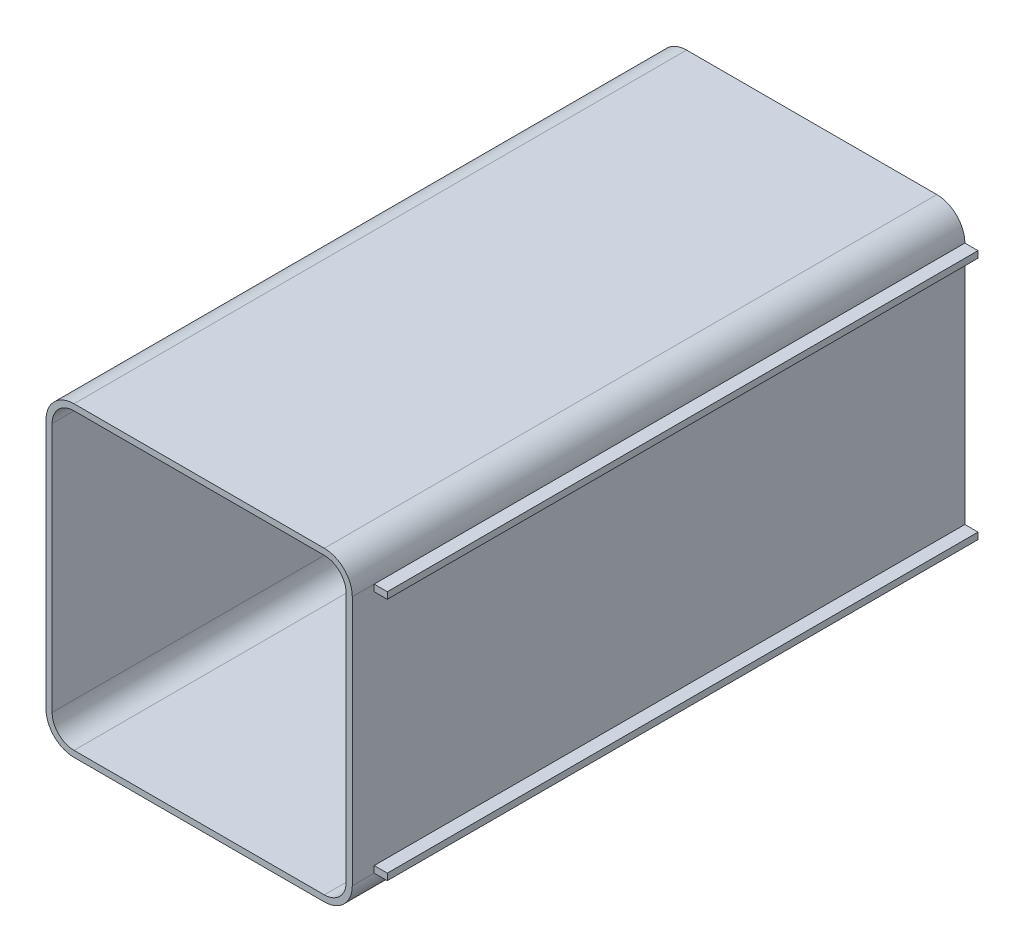
from build123d import *

# Parameters (mm, degrees)
SKETCH1_W           = 70
SKETCH1_H           = 70
BOSS_EXTRUDE1_DEPTH = 140
SKETCH2_W           = 67.2
SKETCH2_H           = 67.2
CUT_EXTRUDE1_DEPTH  = 138.4
FILLET1_R           = 5
FILLET2_R           = 6.4
SKETCH3_W           = 135
SKETCH3_H           = 1.5
BOSS_EXTRUDE2_DEPTH = 3


with BuildPart() as part:
    # Sketch1 → Boss-Extrude1 (new body)
    with BuildSketch(Plane.XY):
        with Locations((35, 35)):
            Rectangle(SKETCH1_W, SKETCH1_H)
    extrude(amount=BOSS_EXTRUDE1_DEPTH)

    # Sketch2 → Cut-Extrude1 (cut)
    with BuildSketch(Plane.XY.offset(140)):
        with Locations((35, 35)):
            Rectangle(SKETCH2_W, SKETCH2_H)
    extrude(amount=-CUT_EXTRUDE1_DEPTH, mode=Mode.SUBTRACT)

    # Fillet1
    fillet1_edges = [part.edges().sort_by_distance(p)[0] for p in [
        (1.4, 1.4, 70.8),
        (1.4, 68.6, 70.8),
        (68.6, 68.6, 70.8),
        (68.6, 1.4, 70.8),
    ]]
    fillet(fillet1_edges, radius=FILLET1_R)

    # Fillet2
    fillet2_edges = [part.edges().sort_by_distance(p)[0] for p in [
        (0, 70, 70),
        (70, 70, 70),
        (70, 0, 70),
        (0, 0, 70),
    ]]
    fillet(fillet2_edges, radius=FILLET2_R)

    # Sketch3 → Boss-Extrude2 (add)
    with BuildSketch(Plane(origin=(70, 0, 0), x_dir=(0, 0, -1), z_dir=(1, 0, 0))):
        with Locations((-67.5, 7.15)):
            Rectangle(SKETCH3_W, SKETCH3_H)
        with Locations((-67.5, 62.85)):
            Rectangle(SKETCH3_W, SKETCH3_H)
    extrude(amount=BOSS_EXTRUDE2_DEPTH)


solid = part.part
